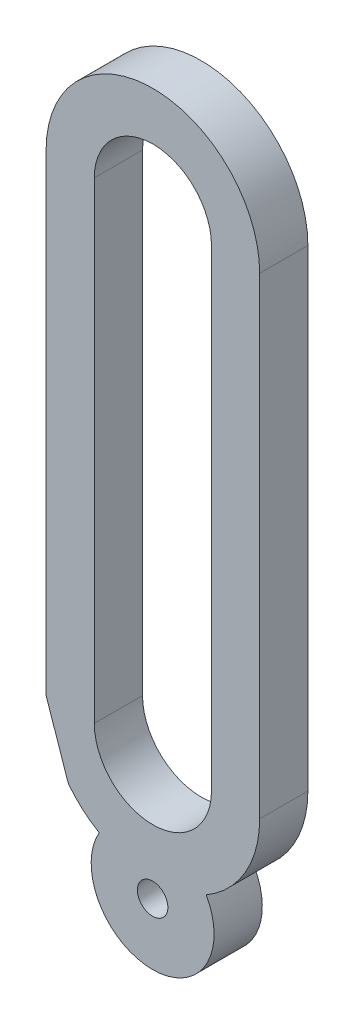
from build123d import *

# Parameters (mm, degrees)
ESTRUSIONE_SOTTILE1_DEPTH    = 10
TAGLIO_ESTRUSIONE2_DEPTH     = 10
SCHIZZO3_R                   = 12.75
SCHIZZO3_R_2                 = 3.161562041
ESTRUSIONE_ESTRUSIONE1_DEPTH = 10


with BuildPart() as part:
    # Schizzo1 → Estrusione-Sottile1 (new body)
    with BuildSketch(Plane.XY):
        with BuildLine():
            Line((22.150088511, 48.999474912), (22.150088511, -48.999474912))
            ThreePointArc((22.150088511, -48.999474912), (0, -71.149563424), (-22.150088511, -48.999474912))
            Line((-22.150088511, -48.999474912), (-22.150088511, 48.999474912))
            ThreePointArc((-22.150088511, 48.999474912), (0, 71.149563424), (22.150088511, 48.999474912))
        make_face()
        with BuildLine():
            Line((12.150088511, 48.999474912), (12.150088511, -48.999474912))
            ThreePointArc((12.150088511, -48.999474912), (0, -61.149563424), (-12.150088511, -48.999474912))
            Line((-12.150088511, -48.999474912), (-12.150088511, 48.999474912))
            ThreePointArc((-12.150088511, 48.999474912), (0, 61.149563424), (12.150088511, 48.999474912))
        make_face(mode=Mode.SUBTRACT)
    extrude(amount=ESTRUSIONE_SOTTILE1_DEPTH)

    # Schizzo2 → Taglio-Estrusione2 (cut)
    with BuildSketch(Plane.XY.offset(10)):
        Polygon((-22.150088511, -48.999474912), (-17.530912976, -62.538068313), (-24.875817955, -62.538068313), (-24.875817955, -48.999474912), align=None)
    extrude(amount=-TAGLIO_ESTRUSIONE2_DEPTH, mode=Mode.SUBTRACT)

    # Schizzo3 → Estrusione-Estrusione1 (add)
    with BuildSketch(Plane.XY.offset(10)):
        with Locations((-0.05861952, -74.447142179)):
            Circle(SCHIZZO3_R)
        with Locations((-0.05861952, -74.447142179)):
            Circle(SCHIZZO3_R_2, mode=Mode.SUBTRACT)
    extrude(amount=-ESTRUSIONE_ESTRUSIONE1_DEPTH)


solid = part.part
